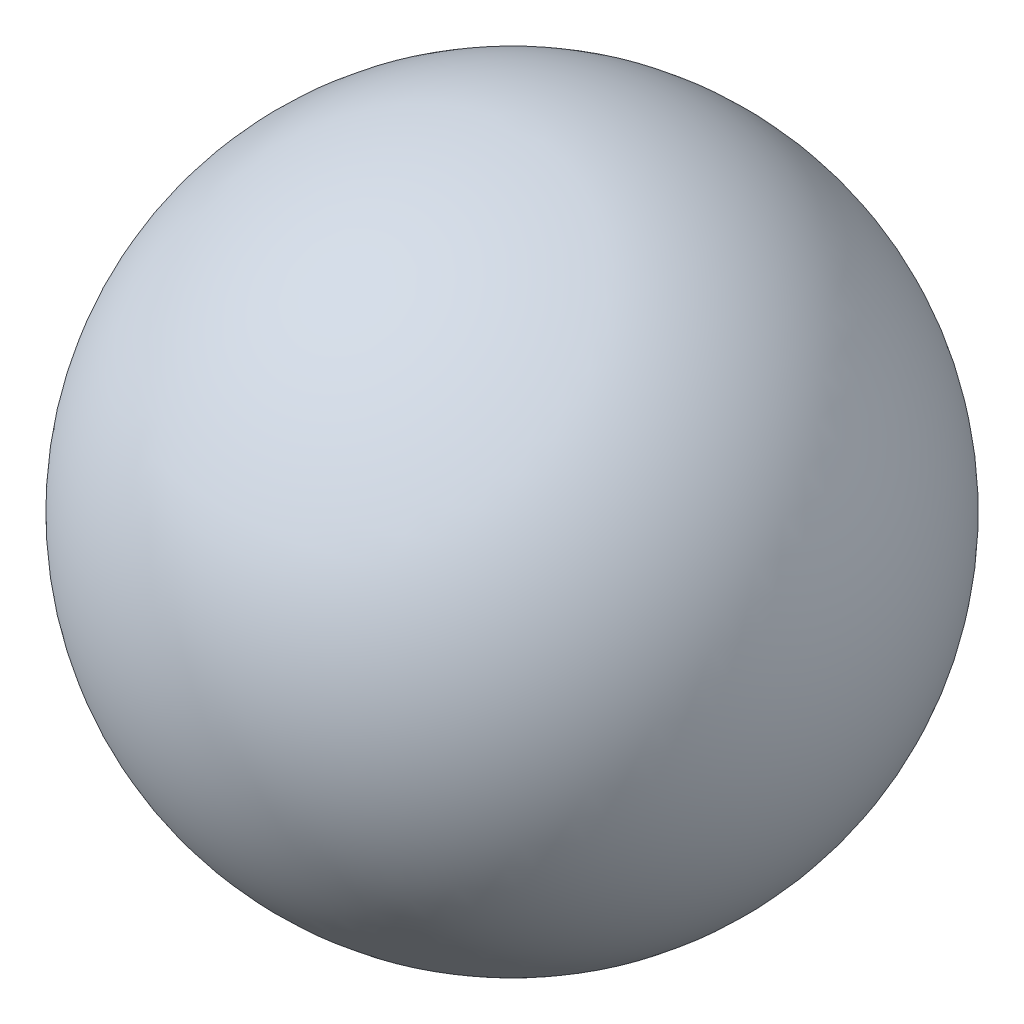
from build123d import *

# Parameters (mm, degrees)
ECHELLE1_SCALE = 0.69


with BuildPart() as part:
    # Esquisse1 → Révolution1 (revolve)
    with BuildSketch(Plane(origin=(0, 0, 0), x_dir=(0, 0, -1), z_dir=(1, 0, 0))):
        with BuildLine():
            Line((0, -4.8), (0, 4.8))
            ThreePointArc((0, 4.8), (-4.8, 0), (0, -4.8))
        make_face()
    revolve(axis=Axis((0, -4.8, 0), (0, 1, 0)))


with BuildPart() as part_1:
    # Echelle1: scaled about (0, 0, 0)
    add(part.part.scale(ECHELLE1_SCALE))


solid = part_1.part
